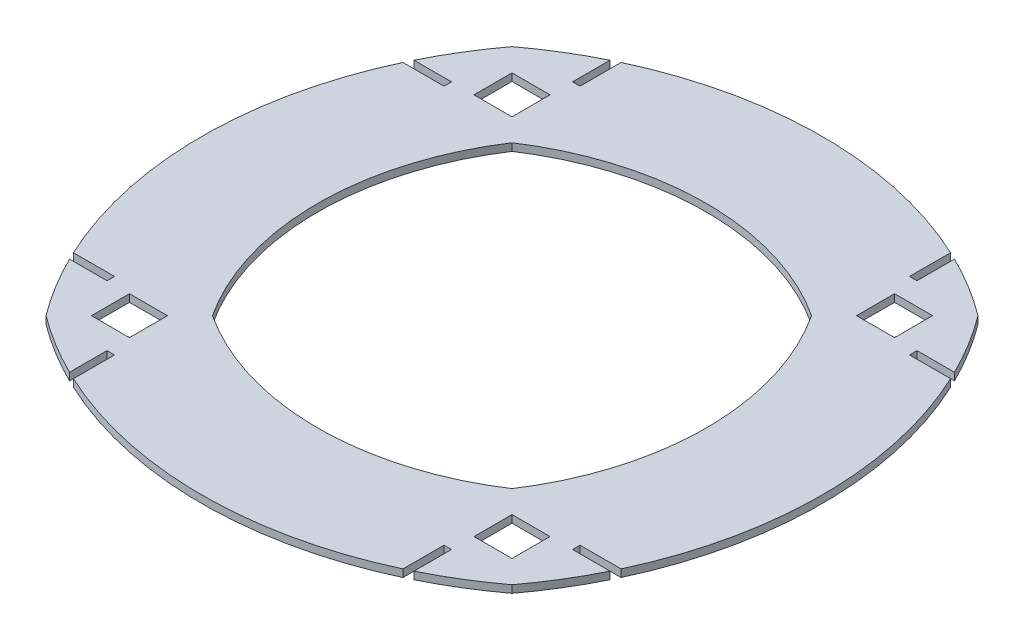
from build123d import *

# Parameters (mm, degrees)
SKETCH1_W           = 25.4
SKETCH1_H           = 25.4
BOSS_EXTRUDE1_DEPTH = 5


with BuildPart() as part:
    # Sketch1 → Boss-Extrude1 (new body)
    with BuildSketch(Plane(origin=(0, 0, 0), x_dir=(1, 0, 0), z_dir=(0, 1, 0))):
        with BuildLine():
            Line((115, 155.4), (110, 155.4))
            Line((110, 155.4), (110, 182.823839407))
            ThreePointArc((110, 182.823839407), (0, 207.239459619), (-110, 182.823839407))
            Line((-110, 182.823839407), (-110, 155.4))
            Line((-110, 155.4), (-115, 155.4))
            Line((-115, 155.4), (-115, 180.423935946))
            ThreePointArc((-115, 180.423935946), (-135.852296559, 168.924266315), (-155.565, 155.565))
            ThreePointArc((-155.565, 155.565), (-168.924266315, 135.852296559), (-180.423935946, 115))
            Line((-180.423935946, 115), (-155.4, 115))
            Line((-155.4, 115), (-155.4, 110))
            Line((-155.4, 110), (-182.823839407, 110))
            ThreePointArc((-182.823839407, 110), (-207.239459619, 0), (-182.823839407, -110))
            Line((-182.823839407, -110), (-155.4, -110))
            Line((-155.4, -110), (-155.4, -115))
            Line((-155.4, -115), (-180.423935946, -115))
            ThreePointArc((-180.423935946, -115), (-168.924266315, -135.852296559), (-155.565, -155.565))
            ThreePointArc((-155.565, -155.565), (-135.852296559, -168.924266315), (-115, -180.423935946))
            Line((-115, -180.423935946), (-115, -155.4))
            Line((-115, -155.4), (-110, -155.4))
            Line((-110, -155.4), (-110, -182.823839407))
            ThreePointArc((-110, -182.823839407), (0, -207.239459619), (110, -182.823839407))
            Line((110, -182.823839407), (110, -155.4))
            Line((110, -155.4), (115, -155.4))
            Line((115, -155.4), (115, -180.423935946))
            ThreePointArc((115, -180.423935946), (135.852296559, -168.924266315), (155.565, -155.565))
            ThreePointArc((155.565, -155.565), (168.924266315, -135.852296559), (180.423935946, -115))
            Line((180.423935946, -115), (155.4, -115))
            Line((155.4, -115), (155.4, -110))
            Line((155.4, -110), (182.823839407, -110))
            ThreePointArc((182.823839407, -110), (207.239459619, 0), (182.823839407, 110))
            Line((182.823839407, 110), (155.4, 110))
            Line((155.4, 110), (155.4, 115))
            Line((155.4, 115), (180.423935946, 115))
            ThreePointArc((180.423935946, 115), (168.924266315, 135.852296559), (155.565, 155.565))
            ThreePointArc((155.565, 155.565), (135.852296559, 168.924266315), (115, 180.423935946))
            Line((115, 180.423935946), (115, 155.4))
        make_face()
        with Locations((127.7, 127.7)):
            Rectangle(SKETCH1_W, SKETCH1_H, mode=Mode.SUBTRACT)
        with Locations((-127.7, 127.7)):
            Rectangle(SKETCH1_W, SKETCH1_H, mode=Mode.SUBTRACT)
        with Locations((127.7, -127.7)):
            Rectangle(SKETCH1_W, SKETCH1_H, mode=Mode.SUBTRACT)
        with Locations((-127.7, -127.7)):
            Rectangle(SKETCH1_W, SKETCH1_H, mode=Mode.SUBTRACT)
        with BuildLine():
            ThreePointArc((-100, 100), (0, 129.820353191), (100, 100))
            ThreePointArc((100, 100), (129.820353191, 0), (100, -100))
            ThreePointArc((100, -100), (0, -129.820353191), (-100, -100))
            ThreePointArc((-100, -100), (-129.820353191, 0), (-100, 100))
        make_face(mode=Mode.SUBTRACT)
    extrude(amount=BOSS_EXTRUDE1_DEPTH)


solid = part.part
